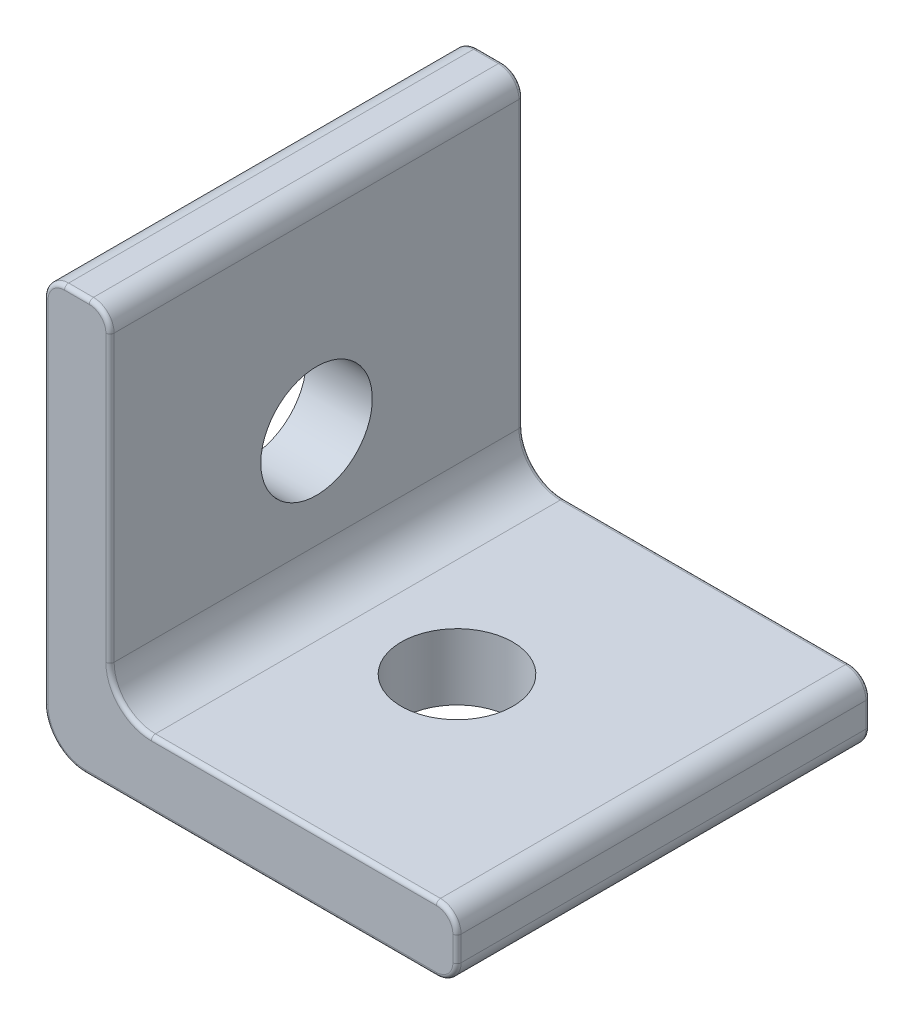
from build123d import *

# Parameters (mm, degrees)
BOSS_EXTRUDE1_DEPTH = 20
FILLET1_R           = 0.2
SKETCH2_R           = 2.7
CUT_EXTRUDE1_DEPTH  = 3.2
SKETCH3_R           = 2.7
CUT_EXTRUDE2_DEPTH  = 3.2


with BuildPart() as part:
    # Sketch1 → Boss-Extrude1 (new body)
    with BuildSketch(Plane.XY):
        with BuildLine():
            Line((5.679190751, 0), (19, 0))
            ThreePointArc((19, 0), (19.707106781, 0.292893219), (20, 1))
            Line((20, 1), (20, 2.2))
            ThreePointArc((20, 2.2), (19.707106781, 2.907106781), (19, 3.2))
            Line((19, 3.2), (5.2, 3.2))
            ThreePointArc((5.2, 3.2), (3.785786438, 3.785786438), (3.2, 5.2))
            Line((3.2, 5.2), (3.2, 19))
            ThreePointArc((3.2, 19), (2.907106781, 19.707106781), (2.2, 20))
            Line((2.2, 20), (1, 20))
            ThreePointArc((1, 20), (0.292893219, 19.707106781), (0, 19))
            Line((0, 19), (0, 2))
            ThreePointArc((0, 2), (0.585786438, 0.585786438), (2, 0))
            Line((2, 0), (5.679190751, 0))
        make_face()
    extrude(amount=BOSS_EXTRUDE1_DEPTH)

    # Fillet1
    fillet1_edges = [part.edges().sort_by_distance(p)[0] for p in [
        (2.907106781, 19.707106781, 20),
        (12.1, 3.2, 0),
        (19.707106781, 2.907106781, 0),
        (20, 1.6, 0),
        (19.707106781, 0.292893219, 0),
        (10.5, 0, 0),
        (0.585786438, 0.585786438, 0),
        (0, 10.5, 0),
        (0.292893219, 19.707106781, 0),
        (1.6, 20, 0),
        (1.6, 20, 20),
        (2.907106781, 19.707106781, 0),
        (3.2, 12.1, 0),
        (3.785786438, 3.785786438, 0),
        (0.292893219, 19.707106781, 20),
        (0, 10.5, 20),
        (0.585786438, 0.585786438, 20),
        (10.5, 0, 20),
        (19.707106781, 0.292893219, 20),
        (20, 1.6, 20),
        (19.707106781, 2.907106781, 20),
        (3.785786438, 3.785786438, 20),
        (12.1, 3.2, 20),
        (3.2, 12.1, 20),
    ]]
    fillet(fillet1_edges, radius=FILLET1_R)

    # Sketch2 → Cut-Extrude1 (cut)
    with BuildSketch(Plane.ZY):
        with Locations((10, 10)):
            Circle(SKETCH2_R)
    extrude(amount=-CUT_EXTRUDE1_DEPTH, mode=Mode.SUBTRACT)

    # Sketch3 → Cut-Extrude2 (cut)
    with BuildSketch(Plane.XZ):
        with Locations(Location((10, 10, 0), (0, 0, 270))):
            Circle(SKETCH3_R)
    extrude(amount=-CUT_EXTRUDE2_DEPTH, mode=Mode.SUBTRACT)


solid = part.part
